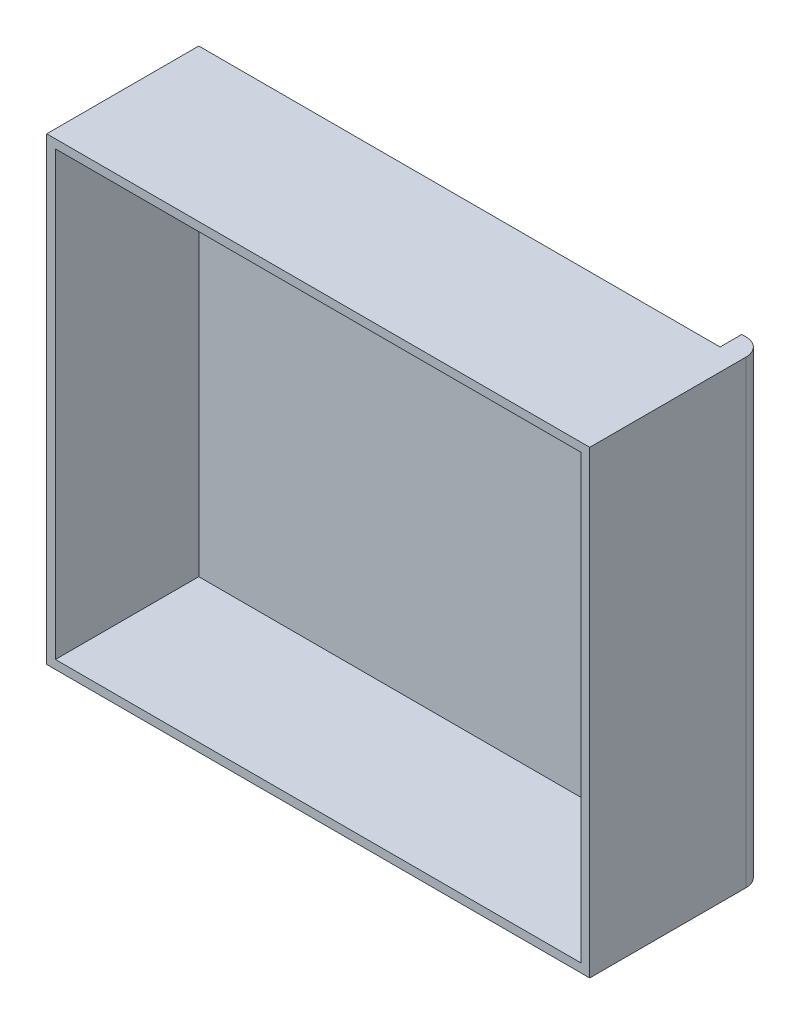
from build123d import *

# Parameters (mm, degrees)
SKETCH_1_W      = 125
SKETCH_1_H      = 105.8
EXTRUDE_1_DEPTH = 35
SHELL_1_T       = -2
SKETCH_2_W      = 5
SKETCH_2_H      = 105.8
EXTRUDE_2_DEPTH = 5
FILLET_1_R      = 4


with BuildPart() as part:
    # 草图1 → 凸台-拉伸1 (new body)
    with BuildSketch(Plane.XY):
        with Locations((62.5, 52.9)):
            Rectangle(SKETCH_1_W, SKETCH_1_H)
    extrude(amount=EXTRUDE_1_DEPTH)

    # 抽壳1
    shell_1_openings = [part.faces().sort_by_distance(p)[0] for p in [
        (62.5, 52.9, 35),
    ]]
    offset(amount=SHELL_1_T, openings=shell_1_openings, kind=Kind.INTERSECTION)

    # 草图2 → 凸台-拉伸2 (add)
    with BuildSketch(Plane(origin=(0, 0, 0), x_dir=(-1, 0, 0), z_dir=(0, 0, -1))):
        with Locations((-122.5, 52.9)):
            Rectangle(SKETCH_2_W, SKETCH_2_H)
    extrude(amount=EXTRUDE_2_DEPTH)

    # 圆角1
    fillet_1_edges = [part.edges().sort_by_distance(p)[0] for p in [
        (125, 52.9, -5),
    ]]
    fillet(fillet_1_edges, radius=FILLET_1_R)


solid = part.part
